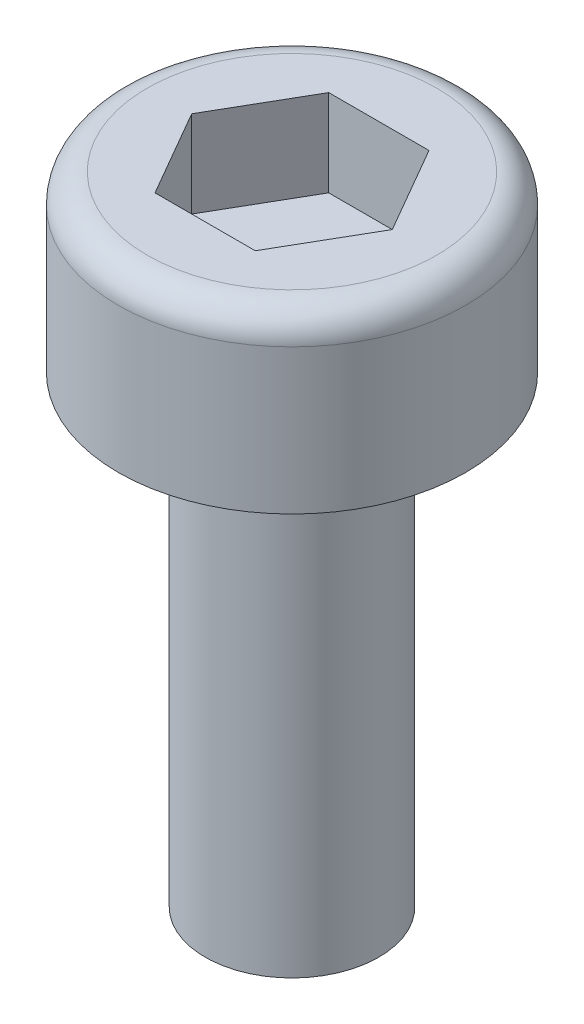
from build123d import *

# Parameters (mm, degrees)
CUT_EXTRUDE1_DEPTH = 3
FILLET1_R          = 1


with BuildPart() as part:
    # Sketch1 → Revolve1 (revolve)
    with BuildSketch(Plane.XY, mode=Mode.PRIVATE) as revolve1_sk:
        Polygon((0, 0), (3, 0), (3, 16), (6, 16), (6, 22), (0, 22), align=None)
    revolve(revolve1_sk.sketch.rotate(Axis((0, 0, 0), (0, 1, 0)), 90), axis=Axis((0, 0, 0), (0, 1, 0)))

    # Sketch2 → Cut-Extrude1 (cut)
    with BuildSketch(Plane(origin=(0, 22, 0), x_dir=(1, 0, 0), z_dir=(0, 1, 0))):
        Polygon((1.732050808, 3), (-1.732050808, 3), (-3.464101615, 0), (-1.732050808, -3), (1.732050808, -3), (3.464101615, 0), align=None)
    extrude(amount=-CUT_EXTRUDE1_DEPTH, mode=Mode.SUBTRACT)

    # Fillet1
    fillet1_edges = [part.edges().sort_by_distance(p)[0] for p in [
        (0, 22, 6),
    ]]
    fillet(fillet1_edges, radius=FILLET1_R)


solid = part.part
